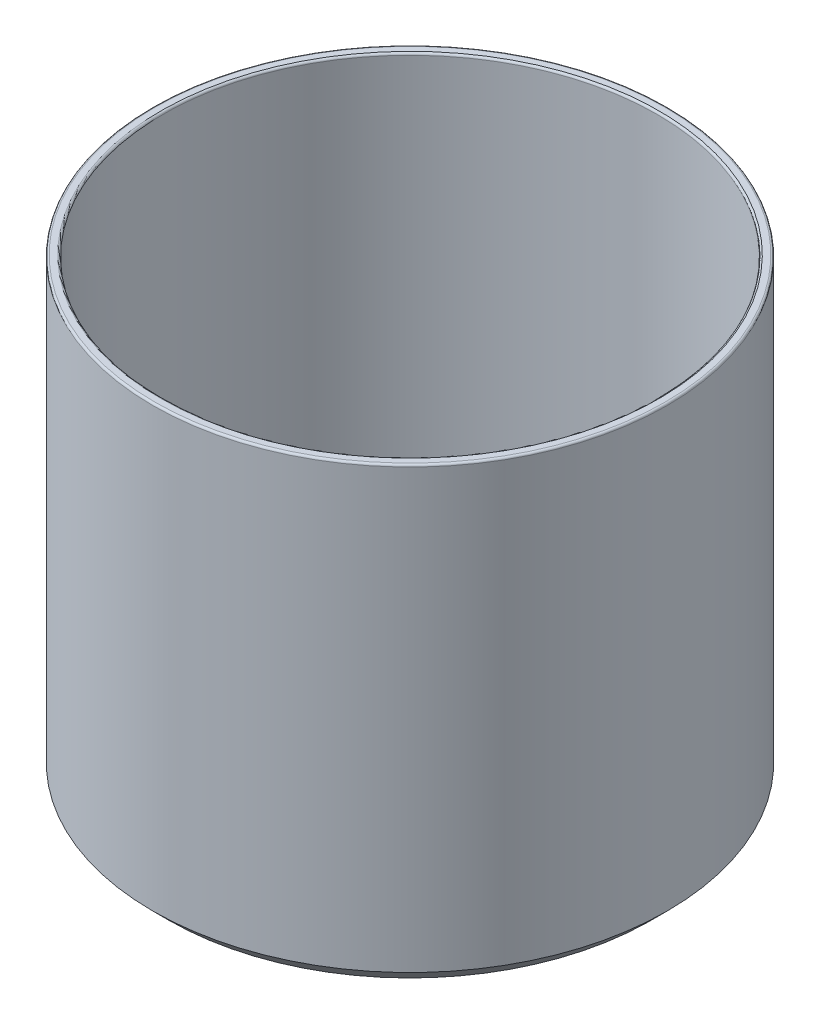
from build123d import *

# Parameters (mm, degrees)
SKETCH_1_R          = 127.5
EXTRUDE_1_DEPTH     = 6
SKETCH_2_R          = 127.5
SKETCH_2_R_2        = 122.5
EXTRUDE_2_DEPTH     = 220
SKETCH_3_R          = 10
CUT_EXTRUDE_1_DEPTH = 200
FILLET_1_R          = 10
CHAMFER_1_SIZE      = 8
FILLET_2_R          = 1
CHAMFER_2_SIZE      = 1
FILLET_3_R          = 1


with BuildPart() as part:
    # 草图1 → 凸台-拉伸1 (new body)
    with BuildSketch(Plane(origin=(0, 0, 0), x_dir=(1, 0, 0), z_dir=(0, 1, 0))):
        with Locations(Location((0, 0, 0), (0, 0, 270))):
            Circle(SKETCH_1_R)
    extrude(amount=EXTRUDE_1_DEPTH)

    # 草图2 → 凸台-拉伸2 (add)
    with BuildSketch(Plane(origin=(0, 6, 0), x_dir=(1, 0, 0), z_dir=(0, 1, 0))):
        with Locations(Location((0, 0, 0), (0, 0, 270))):
            Circle(SKETCH_2_R)
        with Locations(Location((0, 0, 0), (0, 0, 270))):
            Circle(SKETCH_2_R_2, mode=Mode.SUBTRACT)
    extrude(amount=EXTRUDE_2_DEPTH)

    # 草图3 → 切除-拉伸1 (cut)
    with BuildSketch(Plane(origin=(0, 6, 0), x_dir=(1, 0, 0), z_dir=(0, 1, 0))):
        with Locations(Location((0, 0, 0), (0, 0, 270))):
            Circle(SKETCH_3_R)
    extrude(amount=-CUT_EXTRUDE_1_DEPTH, mode=Mode.SUBTRACT)

    # 圆角1
    fillet_1_edges = [part.edges().sort_by_distance(p)[0] for p in [
        (0, 6, -122.5),
    ]]
    fillet(fillet_1_edges, radius=FILLET_1_R)

    # 倒角1
    chamfer_1_edges = [part.edges().sort_by_distance(p)[0] for p in [
        (0, 0, -127.5),
    ]]
    chamfer(chamfer_1_edges, length=CHAMFER_1_SIZE)

    # 圆角2
    fillet_2_edges = [part.edges().sort_by_distance(p)[0] for p in [
        (0, 226, -127.5),
        (0, 226, -122.5),
    ]]
    fillet(fillet_2_edges, radius=FILLET_2_R)

    # 倒角2
    chamfer_2_edges = [part.edges().sort_by_distance(p)[0] for p in [
        (0, 0, -10),
    ]]
    chamfer(chamfer_2_edges, length=CHAMFER_2_SIZE)

    # 圆角3
    fillet_3_edges = [part.edges().sort_by_distance(p)[0] for p in [
        (0, 6, -10),
    ]]
    fillet(fillet_3_edges, radius=FILLET_3_R)


solid = part.part
